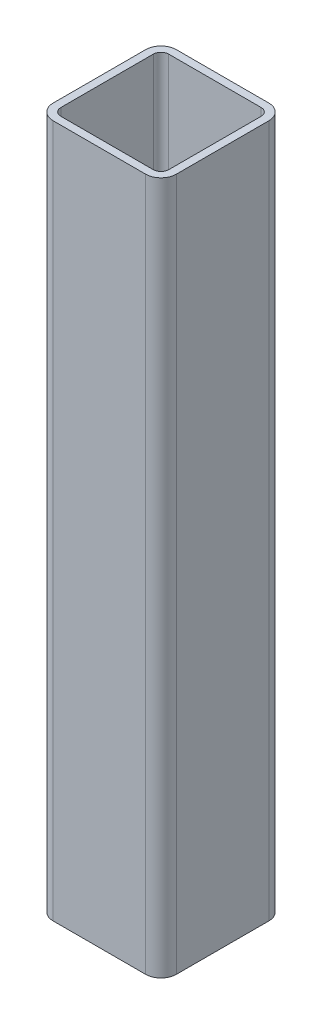
from build123d import *

# Parameters (mm, degrees)
DODANIE_WYCI_GNI_CIE1_DEPTH = 450


with BuildPart() as part:
    # Szkic1 → Dodanie-wyciągnięcie1 (new body)
    with BuildSketch(Plane(origin=(0, 0, 0), x_dir=(1, 0, 0), z_dir=(0, 1, 0))):
        with BuildLine():
            Line((10, 0), (70, 0))
            ThreePointArc((70, 0), (77.071067812, 2.928932188), (80, 10))
            Line((80, 10), (80, 70))
            ThreePointArc((80, 70), (77.071067812, 77.071067812), (70, 80))
            Line((70, 80), (10, 80))
            ThreePointArc((10, 80), (2.928932188, 77.071067812), (0, 70))
            Line((0, 70), (0, 10))
            ThreePointArc((0, 10), (2.928932188, 2.928932188), (10, 0))
        make_face()
        with BuildLine():
            Line((5, 10), (5, 70))
            ThreePointArc((5, 70), (6.464466094, 73.535533906), (10, 75))
            Line((10, 75), (70, 75))
            ThreePointArc((70, 75), (73.535533906, 73.535533906), (75, 70))
            Line((75, 70), (75, 10))
            ThreePointArc((75, 10), (73.535533906, 6.464466094), (70, 5))
            Line((70, 5), (10, 5))
            ThreePointArc((10, 5), (6.464466094, 6.464466094), (5, 10))
        make_face(mode=Mode.SUBTRACT)
    extrude(amount=DODANIE_WYCI_GNI_CIE1_DEPTH)


solid = part.part
